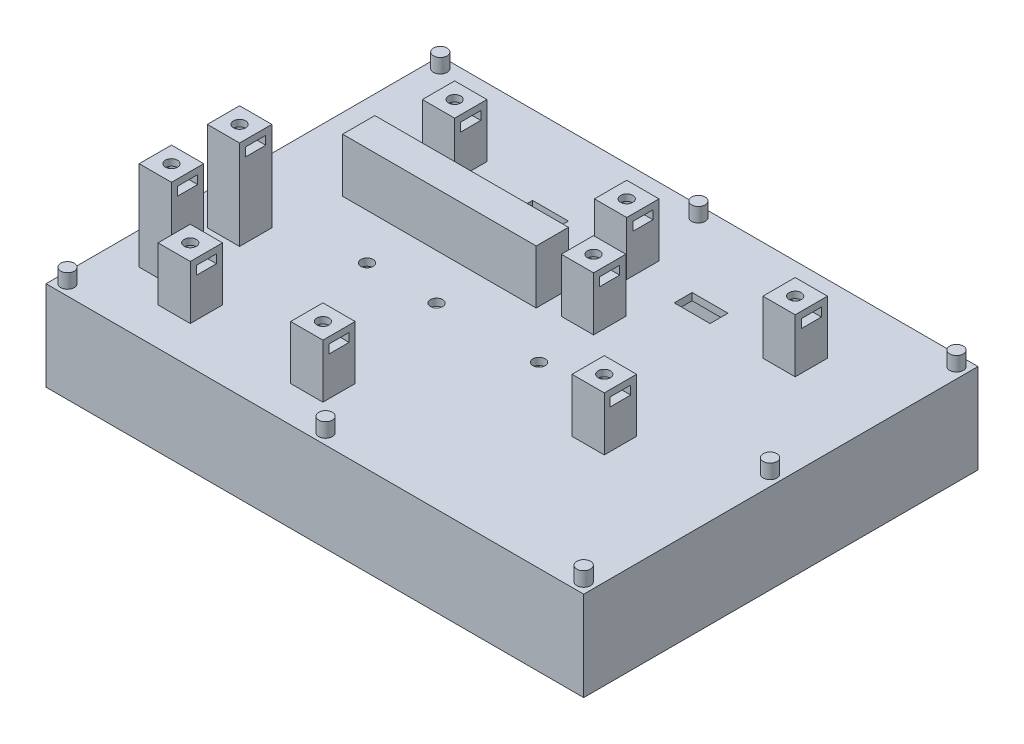
from build123d import *

# Parameters (mm, degrees)
SKETCH1_W                = 150
SKETCH1_H                = 110
BOSS_EXTRUDE1_DEPTH      = 25
SKETCH27_R               = 1.9
CONNECTORS_DEPTH         = 4
SKETCH31_W               = 9
SKETCH31_H               = 9
PILLARS_DEPTH            = 15
M3_CLEARANCE_HOLE3_D     = 3.4
M3_CLEARANCE_HOLE3_DEPTH = 5
M3_CLEARANCE_HOLE3_TIP   = 1.021463052
SKETCH33_W               = 5.7
SKETCH33_H               = 2.4
NUT1_DEPTH               = 10
SKETCH34_W               = 5.6
SKETCH34_H               = 2.4
NUT2_DEPTH               = 10
SKETCH37_W               = 5.6
SKETCH37_H               = 2.4
NUT5_DEPTH               = 10
SKETCH38_W               = 5.6
SKETCH38_H               = 2.4
NUT6_DEPTH               = 10
SKETCH10_W               = 85.5
SKETCH10_H               = 78
BATTERY_HOLDER_DEPTH     = 23
SKETCH39_W               = 7
SKETCH39_H               = 60
DIVIDER_DEPTH            = 10
M3_CLEARANCE_HOLE4_D     = 3.4
M3_CLEARANCE_HOLE4_DEPTH = 5
M3_CLEARANCE_HOLE4_TIP   = 1.021463052
SKETCH41_W               = 10
SKETCH41_H               = 5
BATTERY_WIRE_DEPTH       = 2
SKETCH42_R               = 2
CONNECTOR_BOTTOM_DEPTH   = 5
SKETCH43_W               = 54
SKETCH43_H               = 9
PCB_REST_DEPTH           = 15
SKETCH44_W               = 5.6
SKETCH44_H               = 2.4
NUT3_DEPTH               = 10
SKETCH45_W               = 5.6
SKETCH45_H               = 2.4
NUT4_DEPTH               = 10
SKETCH46_W               = 5.6
SKETCH46_H               = 2.4
NUT7_DEPTH               = 10
SKETCH48_W               = 9
SKETCH48_H               = 9
PCBINPUT_PILLARS_DEPTH   = 25
NUT8_REACH               = 187.691
SKETCH49_W               = 5.6
SKETCH49_H               = 2.4
NUT9_REACH               = 187.691
SKETCH50_W               = 5.6
SKETCH50_H               = 2.4
M3_CLEARANCE_HOLE5_D     = 3.4
M3_CLEARANCE_HOLE5_DEPTH = 5
M3_CLEARANCE_HOLE5_TIP   = 1.021463052


with BuildPart() as part:
    # Sketch1 → Boss-Extrude1 (new body)
    with BuildSketch(Plane(origin=(0, 0, 0), x_dir=(1, 0, 0), z_dir=(0, 1, 0))):
        with Locations((75, 55)):
            Rectangle(SKETCH1_W, SKETCH1_H)
    extrude(amount=BOSS_EXTRUDE1_DEPTH)

    # Sketch27 → Connectors (add)
    with BuildSketch(Plane(origin=(0, 25, 0), x_dir=(1, 0, 0), z_dir=(0, 1, 0))):
        with Locations(Location((3, 107, 0), (0, 0, 90))):
            Circle(SKETCH27_R)
        with Locations(Location((75, 107, 0), (0, 0, 90))):
            Circle(SKETCH27_R)
        with Locations(Location((147, 107, 0), (0, 0, 90))):
            Circle(SKETCH27_R)
        with Locations(Location((147, 55, 0), (0, 0, 90))):
            Circle(SKETCH27_R)
        with Locations(Location((147, 3, 0), (0, 0, 90))):
            Circle(SKETCH27_R)
        with Locations(Location((75, 3, 0), (0, 0, 90))):
            Circle(SKETCH27_R)
        with Locations(Location((3, 3, 0), (0, 0, 90))):
            Circle(SKETCH27_R)
        with Locations(Location((3, 55, 0), (0, 0, 90))):
            Circle(SKETCH27_R)
    extrude(amount=CONNECTORS_DEPTH)

    # Sketch31 → Pillars (add)
    with BuildSketch(Plane(origin=(0, 25, 0), x_dir=(1, 0, 0), z_dir=(0, 1, 0))):
        with Locations((122.5, 86.5)):
            Rectangle(SKETCH31_W, SKETCH31_H)
        with Locations((25.25, 15)):
            Rectangle(SKETCH31_W, SKETCH31_H)
        with Locations((62.75, 14.5)):
            Rectangle(SKETCH31_W, SKETCH31_H)
        with Locations((114.75, 41)):
            Rectangle(SKETCH31_W, SKETCH31_H)
        with Locations((84.25, 68.5)):
            Rectangle(SKETCH31_W, SKETCH31_H)
        with Locations((75.5, 86.5)):
            Rectangle(SKETCH31_W, SKETCH31_H)
        with Locations((27.5, 86.5)):
            Rectangle(SKETCH31_W, SKETCH31_H)
    extrude(amount=PILLARS_DEPTH)

    # M3 Clearance Hole3
    with Locations(Plane(origin=(84.25, 40, -68.5), x_dir=(0, 0, 1), z_dir=(0, 1, 0))):
        with Locations((0, 0), (27.5, 30.5), (54, -21.5), (53.5, -59), (-18, -56.75), (-18, -8.75), (-18, 38.25)):
            Hole(M3_CLEARANCE_HOLE3_D / 2, depth=M3_CLEARANCE_HOLE3_DEPTH)
            with Locations((0, 0, -(M3_CLEARANCE_HOLE3_DEPTH + M3_CLEARANCE_HOLE3_TIP / 2))):  # 118° drill point
                Cone(0, M3_CLEARANCE_HOLE3_D / 2, M3_CLEARANCE_HOLE3_TIP, mode=Mode.SUBTRACT)

    # Sketch33 → Nut1 (cut)
    with BuildSketch(Plane(origin=(119.25, 0, 0), x_dir=(0, 0, -1), z_dir=(1, 0, 0))):
        with Locations((41, 37)):
            Rectangle(SKETCH33_W, SKETCH33_H)
    extrude(amount=-NUT1_DEPTH, mode=Mode.SUBTRACT)

    # Sketch34 → Nut2 (cut)
    with BuildSketch(Plane(origin=(88.75, 0, 0), x_dir=(0, 0, -1), z_dir=(1, 0, 0))):
        with Locations((68.5, 37)):
            Rectangle(SKETCH34_W, SKETCH34_H)
    extrude(amount=-NUT2_DEPTH, mode=Mode.SUBTRACT)

    # Sketch37 → Nut5 (cut)
    with BuildSketch(Plane(origin=(67.25, 0, 0), x_dir=(0, 0, -1), z_dir=(1, 0, 0))):
        with Locations((14.5, 37)):
            Rectangle(SKETCH37_W, SKETCH37_H)
    extrude(amount=-NUT5_DEPTH, mode=Mode.SUBTRACT)

    # Sketch38 → Nut6 (cut)
    with BuildSketch(Plane(origin=(29.75, 0, 0), x_dir=(0, 0, -1), z_dir=(1, 0, 0))):
        with Locations((15, 37)):
            Rectangle(SKETCH38_W, SKETCH38_H)
    extrude(amount=-NUT6_DEPTH, mode=Mode.SUBTRACT)

    # Sketch10 → Battery holder (cut)
    with BuildSketch(Plane.XZ):
        with Locations((75, -51)):
            Rectangle(SKETCH10_W, SKETCH10_H)
    extrude(amount=-BATTERY_HOLDER_DEPTH, mode=Mode.SUBTRACT)

    # Sketch39 → Divider (add)
    with BuildSketch(Plane.XZ.offset(-23)):
        with Locations((73.25, -46)):
            Rectangle(SKETCH39_W, SKETCH39_H)
    extrude(amount=DIVIDER_DEPTH)

    # M3 Clearance Hole4
    with Locations(Plane(origin=(107.15, 23, -49.8), x_dir=(0, 0, -1), z_dir=(0, -1, 0))):
        with Locations((0, 0), (0, -19.4), (0, -48), (0, -67.4)):
            Hole(M3_CLEARANCE_HOLE4_D / 2, depth=M3_CLEARANCE_HOLE4_DEPTH)
            with Locations((0, 0, -(M3_CLEARANCE_HOLE4_DEPTH + M3_CLEARANCE_HOLE4_TIP / 2))):  # 118° drill point
                Cone(0, M3_CLEARANCE_HOLE4_D / 2, M3_CLEARANCE_HOLE4_TIP, mode=Mode.SUBTRACT)

    # Sketch41 → Battery wire (cut)
    with BuildSketch(Plane.XZ.offset(-23)):
        with Locations((97.25, -85.5)):
            Rectangle(SKETCH41_W, SKETCH41_H)
        with Locations((52.75, -85.5)):
            Rectangle(SKETCH41_W, SKETCH41_H)
    extrude(amount=-BATTERY_WIRE_DEPTH, mode=Mode.SUBTRACT)

    # Sketch42 → Connector bottom (cut)
    with BuildSketch(Plane.XZ):
        with Locations(Location((119.25, -10.5, 0), (0, 0, 270))):
            Circle(SKETCH42_R)
        with Locations(Location((30.75, -10.5, 0), (0, 0, 270))):
            Circle(SKETCH42_R)
        with Locations(Location((30.75, -91.5, 0), (0, 0, 270))):
            Circle(SKETCH42_R)
        with Locations(Location((119.25, -91.5, 0), (0, 0, 270))):
            Circle(SKETCH42_R)
    extrude(amount=-CONNECTOR_BOTTOM_DEPTH, mode=Mode.SUBTRACT)

    # Sketch43 → PCB rest (add)
    with BuildSketch(Plane(origin=(0, 25, 0), x_dir=(1, 0, 0), z_dir=(0, 1, 0))):
        with Locations((47.25, 67)):
            Rectangle(SKETCH43_W, SKETCH43_H)
    extrude(amount=PCB_REST_DEPTH)

    # Sketch44 → Nut3 (cut)
    with BuildSketch(Plane(origin=(127, 0, 0), x_dir=(0, 0, -1), z_dir=(1, 0, 0))):
        with Locations((86.5, 37)):
            Rectangle(SKETCH44_W, SKETCH44_H)
    extrude(amount=-NUT3_DEPTH, mode=Mode.SUBTRACT)

    # Sketch45 → Nut4 (cut)
    with BuildSketch(Plane(origin=(80, 0, 0), x_dir=(0, 0, -1), z_dir=(1, 0, 0))):
        with Locations((86.5, 37)):
            Rectangle(SKETCH45_W, SKETCH45_H)
    extrude(amount=-NUT4_DEPTH, mode=Mode.SUBTRACT)

    # Sketch46 → Nut7 (cut)
    with BuildSketch(Plane(origin=(32, 0, 0), x_dir=(0, 0, -1), z_dir=(1, 0, 0))):
        with Locations((86.5, 37)):
            Rectangle(SKETCH46_W, SKETCH46_H)
    extrude(amount=-NUT7_DEPTH, mode=Mode.SUBTRACT)

    # Sketch48 → PCBInput pillars (add)
    with BuildSketch(Plane(origin=(0, 25, 0), x_dir=(1, 0, 0), z_dir=(0, 1, 0))):
        with Locations((13.5, 40.5)):
            Rectangle(SKETCH48_W, SKETCH48_H)
        with Locations((13.5, 21.5)):
            Rectangle(SKETCH48_W, SKETCH48_H)
    extrude(amount=PCBINPUT_PILLARS_DEPTH)

    # Sketch49 → Nut8 (cut, up to next)
    with BuildSketch(Plane.ZY.offset(-9), mode=Mode.PRIVATE) as nut8_sk1:
        with Locations((-21.5, 47)):
            Rectangle(SKETCH49_W, SKETCH49_H)
    nut8_tool1 = extrude(nut8_sk1.sketch, amount=-NUT8_REACH, mode=Mode.PRIVATE) & part.part
    add(nut8_tool1.solids().sort_by_distance((9, 47, -21.5))[0], mode=Mode.SUBTRACT)

    # Sketch50 → Nut9 (cut, up to next)
    with BuildSketch(Plane.ZY.offset(-9), mode=Mode.PRIVATE) as nut9_sk1:
        with Locations((-40.5, 47)):
            Rectangle(SKETCH50_W, SKETCH50_H)
    nut9_tool1 = extrude(nut9_sk1.sketch, amount=-NUT9_REACH, mode=Mode.PRIVATE) & part.part
    add(nut9_tool1.solids().sort_by_distance((9, 47, -40.5))[0], mode=Mode.SUBTRACT)

    # M3 Clearance Hole5
    with Locations(Plane(origin=(13.5, 50, -40.5), x_dir=(0, 0, 1), z_dir=(0, 1, 0))):
        with Locations((0, 0), (19, 0)):
            Hole(M3_CLEARANCE_HOLE5_D / 2, depth=M3_CLEARANCE_HOLE5_DEPTH)
            with Locations((0, 0, -(M3_CLEARANCE_HOLE5_DEPTH + M3_CLEARANCE_HOLE5_TIP / 2))):  # 118° drill point
                Cone(0, M3_CLEARANCE_HOLE5_D / 2, M3_CLEARANCE_HOLE5_TIP, mode=Mode.SUBTRACT)


solid = part.part
